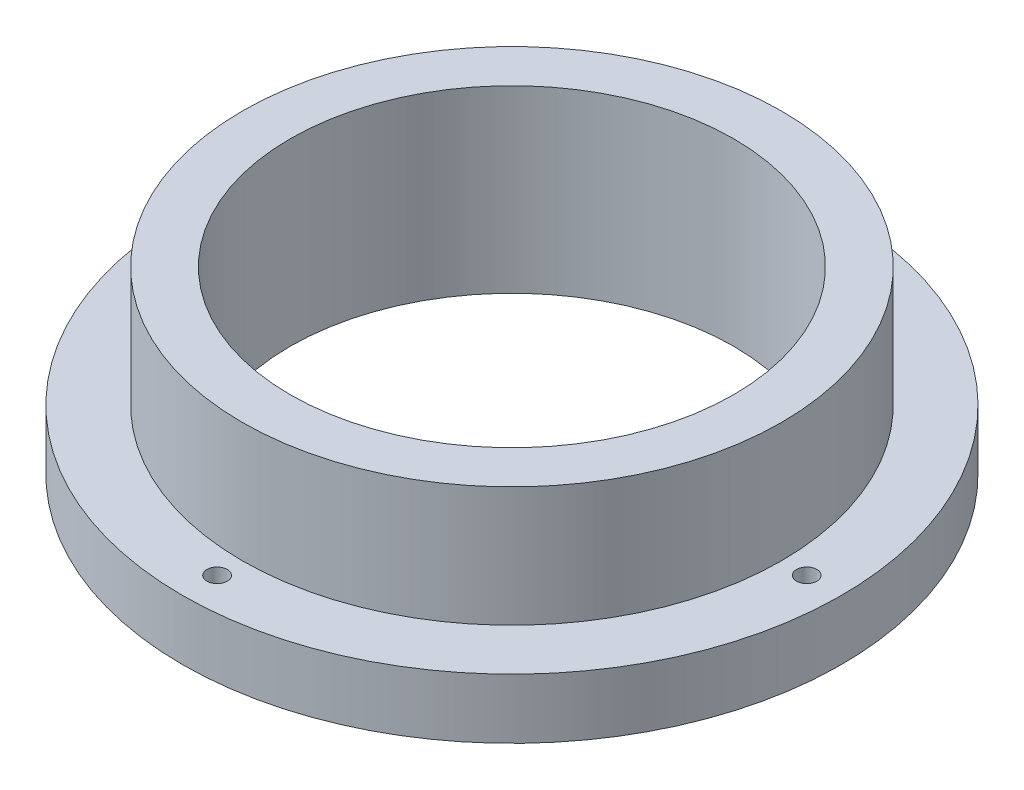
from build123d import *

# Parameters (mm, degrees)
SKETCH_2_R          = 27.5
SKETCH_2_R_2        = 0.85
EXTRUDE_1_DEPTH     = 5
SKETCH_3_R          = 22.5
EXTRUDE_2_DEPTH     = 10
SKETCH_4_R          = 18.5
CUT_EXTRUDE_1_DEPTH = 42.683330001


with BuildPart() as part:
    # 草图2 → 凸台-拉伸1 (new body)
    with BuildSketch(Plane(origin=(0, 0, 0), x_dir=(1, 0, 0), z_dir=(0, 1, 0))):
        with Locations(Location((0, 0, 0), (0, 0, 270))):
            Circle(SKETCH_2_R)
        with Locations(Location((0, 24.6, 0), (0, 0, 270))):
            Circle(SKETCH_2_R_2, mode=Mode.SUBTRACT)
        with Locations(Location((24.6, 0, 0), (0, 0, 270))):
            Circle(SKETCH_2_R_2, mode=Mode.SUBTRACT)
        with Locations(Location((0, -24.6, 0), (0, 0, 270))):
            Circle(SKETCH_2_R_2, mode=Mode.SUBTRACT)
        with Locations(Location((-24.6, 0, 0), (0, 0, 270))):
            Circle(SKETCH_2_R_2, mode=Mode.SUBTRACT)
    extrude(amount=EXTRUDE_1_DEPTH)

    # 草图3 → 凸台-拉伸2 (add)
    with BuildSketch(Plane(origin=(0, 5, 0), x_dir=(1, 0, 0), z_dir=(0, 1, 0))):
        with Locations(Location((0, 0, 0), (0, 0, 270))):
            Circle(SKETCH_3_R)
    extrude(amount=EXTRUDE_2_DEPTH)

    # 草图4 → 切除-拉伸1 (cut, through all)
    with BuildSketch(Plane(origin=(0, 15, 0), x_dir=(1, 0, 0), z_dir=(0, 1, 0))):
        with Locations(Location((0, 0, 0), (0, 0, 270))):
            Circle(SKETCH_4_R)
    extrude(amount=-CUT_EXTRUDE_1_DEPTH, mode=Mode.SUBTRACT)


solid = part.part
